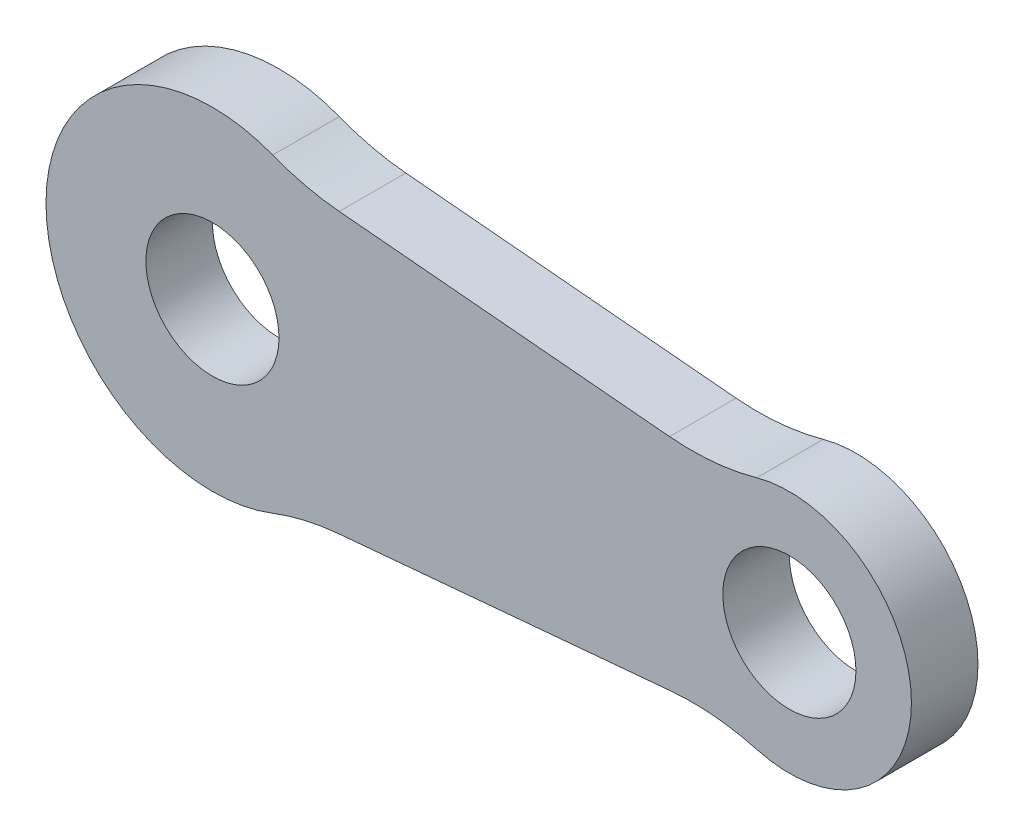
from build123d import *

# Parameters (mm, degrees)
SKETCH1_R           = 15
BOSS_EXTRUDE1_DEPTH = 15


with BuildPart() as part:
    # Sketch1 → Boss-Extrude1 (new body)
    with BuildSketch(Plane.XY):
        with BuildLine():
            Line((28.572836517, 31.436384873), (102.991653714, 24.717874937))
            ThreePointArc((102.991653714, 24.717874937), (112.899157953, 24.719408673), (122.645642046, 26.498366347))
            ThreePointArc((122.645642046, 26.498366347), (157.499970317, 0.040405059), (122.723540483, -26.519863063))
            ThreePointArc((122.723540483, -26.519863063), (113.057776166, -24.777149314), (103.236165654, -24.781389639))
            Line((103.236165654, -24.781389639), (28.345604458, -31.527580033))
            ThreePointArc((28.345604458, -31.527580033), (20.79820156, -32.740835791), (13.491916318, -34.988829561))
            ThreePointArc((13.491916318, -34.988829561), (-37.499964301, 0.05174385), (13.588422543, 34.951463099))
            ThreePointArc((13.588422543, 34.951463099), (20.957064485, 32.667179012), (28.572836517, 31.436384873))
        make_face()
        Circle(SKETCH1_R, mode=Mode.SUBTRACT)
        with Locations((130, 0)):
            Circle(SKETCH1_R, mode=Mode.SUBTRACT)
    extrude(amount=BOSS_EXTRUDE1_DEPTH)


solid = part.part
